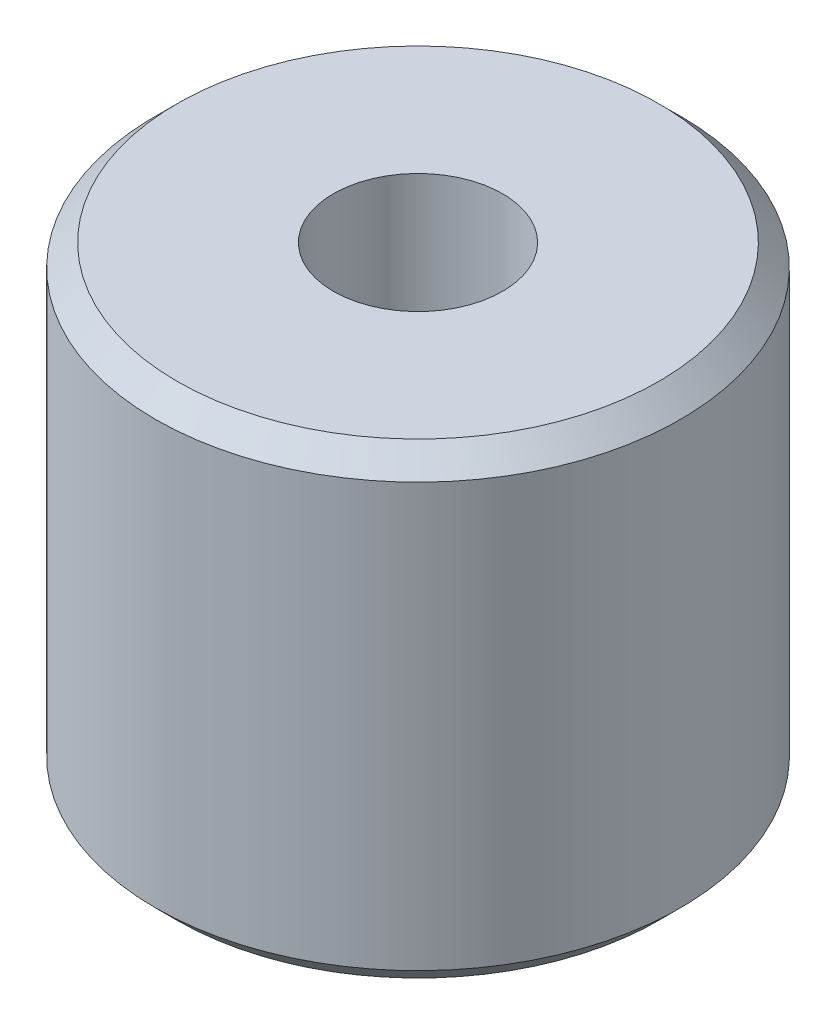
from build123d import *

# Parameters (mm, degrees)
SKETCH1_R           = 18
BOSS_EXTRUDE1_DEPTH = 32
SKETCH2_R           = 5.8
CUT_EXTRUDE1_DEPTH  = 41.890096601
CHAMFER1_SIZE       = 1.5


with BuildPart() as part:
    # Sketch1 → Boss-Extrude1 (new body)
    with BuildSketch(Plane(origin=(0, 0, 0), x_dir=(1, 0, 0), z_dir=(0, 1, 0))):
        with Locations(Location((0, 0, 0), (0, 0, 270))):
            Circle(SKETCH1_R)
    extrude(amount=BOSS_EXTRUDE1_DEPTH)

    # Sketch2 → Cut-Extrude1 (cut, through all)
    with BuildSketch(Plane(origin=(0, 32, 0), x_dir=(1, 0, 0), z_dir=(0, 1, 0))):
        with Locations(Location((0, 0, 0), (0, 0, 270))):
            Circle(SKETCH2_R)
    extrude(amount=-CUT_EXTRUDE1_DEPTH, mode=Mode.SUBTRACT)

    # Chamfer1
    chamfer1_edges = [part.edges().sort_by_distance(p)[0] for p in [
        (0, 0, -18),
        (0, 32, -18),
    ]]
    chamfer(chamfer1_edges, length=CHAMFER1_SIZE)


solid = part.part
